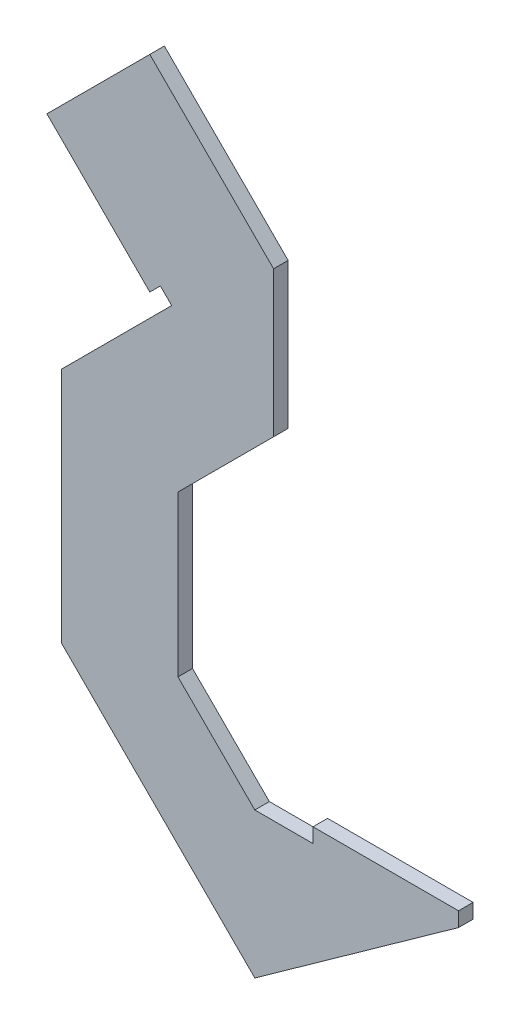
from build123d import *

# Parameters (mm, degrees)
BOSS_EXTRUDE1_DEPTH = 0.05


with BuildPart() as part:
    # Sketch1 → Boss-Extrude1 (new, symmetric)
    with BuildSketch(Plane.XY):
        Polygon((0, 0), (-1, 0), (-1, -0.1), (-1.4, -0.1), (-1.92799329, 0.42799329), (-1.92799329, 1.528202877), (-1.270991302, 2.185204865), (-1.270991302, 3.185204865), (-2.121542086, 4.035755648), (-2.828648867, 3.328648867), (-2.121542086, 2.621542086), (-2.049038167, 2.694046004), (-1.97127959, 2.616287427), (-2.72799329, 1.859573727), (-2.72799329, 0.22799329), (-1.4, -1.1), (0, -0.1), align=None)
    extrude(amount=BOSS_EXTRUDE1_DEPTH, both=True)


solid = part.part
